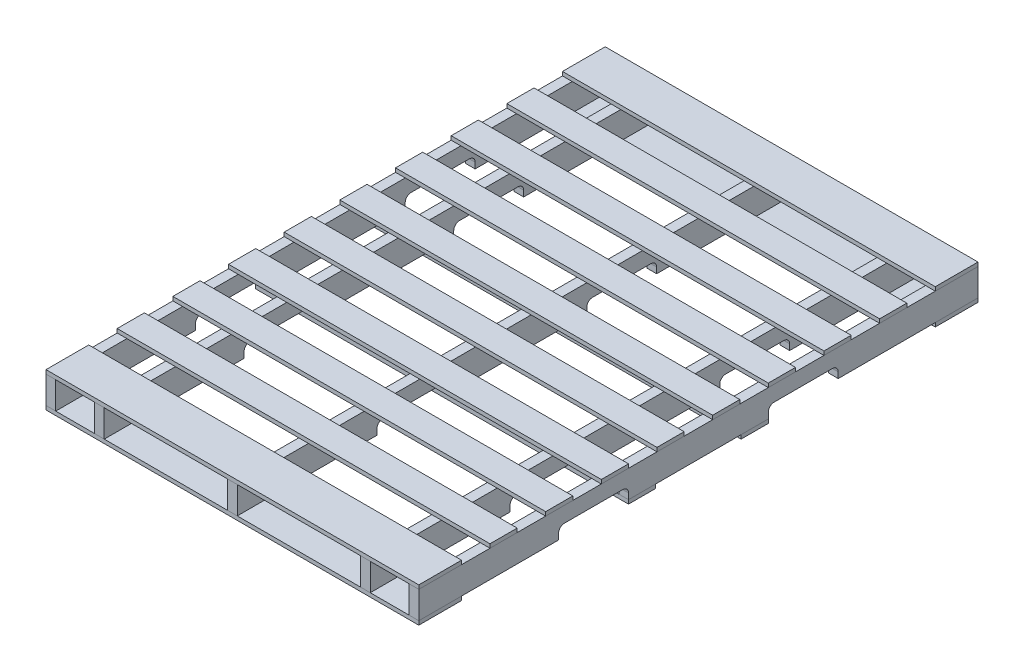
from build123d import *

# Parameters (mm, degrees)
BOSS_EXTRUDE1_DEPTH        = 914.4
BOSS_EXTRUDE1_DEPTH_BACK   = 914.4
SKETCH3_W                  = 31.75
SKETCH3_H                  = 88.9
BOSS_EXTRUDE1_2_DEPTH      = 914.4
BOSS_EXTRUDE1_2_DEPTH_BACK = 914.4
BOSS_EXTRUDE1_3_DEPTH      = 914.4
BOSS_EXTRUDE1_3_DEPTH_BACK = 914.4
BOSS_EXTRUDE1_4_DEPTH      = 914.4
BOSS_EXTRUDE1_4_DEPTH_BACK = 914.4
BOSS_EXTRUDE1_5_DEPTH      = 914.4
BOSS_EXTRUDE1_5_DEPTH_BACK = 914.4
SKETCH4_W                  = 1219.2
SKETCH4_H                  = 139.7
BOSS_EXTRUDE2_DEPTH        = 12.7
BOSS_EXTRUDE2_2_DEPTH      = 12.7
SKETCH4_H_2                = 88.9
BOSS_EXTRUDE2_3_DEPTH      = 12.7
BOSS_EXTRUDE2_4_DEPTH      = 12.7
BOSS_EXTRUDE2_5_DEPTH      = 12.7
BOSS_EXTRUDE2_6_DEPTH      = 12.7
BOSS_EXTRUDE2_7_DEPTH      = 12.7
BOSS_EXTRUDE2_8_DEPTH      = 12.7
BOSS_EXTRUDE2_9_DEPTH      = 12.7
BOSS_EXTRUDE2_10_DEPTH     = 12.7
SKETCH5_W                  = 1219.2
SKETCH5_H                  = 139.7
BOSS_EXTRUDE3_DEPTH        = 12.7
BOSS_EXTRUDE3_2_DEPTH      = 12.7
SKETCH5_H_2                = 88.9
BOSS_EXTRUDE3_3_DEPTH      = 12.7
BOSS_EXTRUDE3_4_DEPTH      = 12.7
CUT_EXTRUDE2_DEPTH         = 1526.071186043
CUT_EXTRUDE2_DEPTH_BACK    = 1526.071186043


with BuildPart() as part:
    # Sketch3 → Boss-Extrude1 (new, two sides: drawn at the far end of the back side and taken through both)
    with BuildSketch(Plane.XY.offset(-BOSS_EXTRUDE1_DEPTH_BACK)):
        with Locations((-593.725, 0)):
            Rectangle(SKETCH3_W, SKETCH3_H)
    extrude(amount=BOSS_EXTRUDE1_DEPTH + BOSS_EXTRUDE1_DEPTH_BACK)


with BuildPart() as body_2:
    # Sketch3 → Boss-Extrude1 2 (new, two sides: drawn at the far end of the back side and taken through both)
    with BuildSketch(Plane.XY.offset(-BOSS_EXTRUDE1_2_DEPTH_BACK)):
        with Locations((434.975, 0)):
            Rectangle(SKETCH3_W, SKETCH3_H)
    extrude(amount=BOSS_EXTRUDE1_2_DEPTH + BOSS_EXTRUDE1_2_DEPTH_BACK)


with BuildPart() as body_3:
    # Sketch3 → Boss-Extrude1 3 (new, two sides: drawn at the far end of the back side and taken through both)
    with BuildSketch(Plane.XY.offset(-BOSS_EXTRUDE1_3_DEPTH_BACK)):
        with Locations((593.725, 0)):
            Rectangle(SKETCH3_W, SKETCH3_H)
    extrude(amount=BOSS_EXTRUDE1_3_DEPTH + BOSS_EXTRUDE1_3_DEPTH_BACK)


with BuildPart() as body_4:
    # Sketch3 → Boss-Extrude1 4 (new, two sides: drawn at the far end of the back side and taken through both)
    with BuildSketch(Plane.XY.offset(-BOSS_EXTRUDE1_4_DEPTH_BACK)):
        with Locations((-434.975, 0)):
            Rectangle(SKETCH3_W, SKETCH3_H)
    extrude(amount=BOSS_EXTRUDE1_4_DEPTH + BOSS_EXTRUDE1_4_DEPTH_BACK)


with BuildPart() as body_5:
    # Sketch3 → Boss-Extrude1 5 (new, two sides: drawn at the far end of the back side and taken through both)
    with BuildSketch(Plane.XY.offset(-BOSS_EXTRUDE1_5_DEPTH_BACK)):
        Rectangle(SKETCH3_W, SKETCH3_H)
    extrude(amount=BOSS_EXTRUDE1_5_DEPTH + BOSS_EXTRUDE1_5_DEPTH_BACK)


with BuildPart() as body_6:
    # Sketch4 → Boss-Extrude2 (new body)
    with BuildSketch(Plane(origin=(0, 44.45, 0), x_dir=(1, 0, 0), z_dir=(0, 1, 0))):
        with Locations((0, -844.55)):
            Rectangle(SKETCH4_W, SKETCH4_H)
    extrude(amount=BOSS_EXTRUDE2_DEPTH)


with BuildPart() as body_7:
    # Sketch4 → Boss-Extrude2 2 (new body)
    with BuildSketch(Plane(origin=(0, 44.45, 0), x_dir=(1, 0, 0), z_dir=(0, 1, 0))):
        with Locations((0, 844.55)):
            Rectangle(SKETCH4_W, SKETCH4_H)
    extrude(amount=BOSS_EXTRUDE2_2_DEPTH)


with BuildPart() as body_8:
    # Sketch4 → Boss-Extrude2 3 (new body)
    with BuildSketch(Plane(origin=(0, 44.45, 0), x_dir=(1, 0, 0), z_dir=(0, 1, 0))):
        with Locations((0, -637.116666667)):
            Rectangle(SKETCH4_W, SKETCH4_H_2)
    extrude(amount=BOSS_EXTRUDE2_3_DEPTH)


with BuildPart() as body_9:
    # Sketch4 → Boss-Extrude2 4 (new body)
    with BuildSketch(Plane(origin=(0, 44.45, 0), x_dir=(1, 0, 0), z_dir=(0, 1, 0))):
        with Locations((0, -455.083333333)):
            Rectangle(SKETCH4_W, SKETCH4_H_2)
    extrude(amount=BOSS_EXTRUDE2_4_DEPTH)


with BuildPart() as body_10:
    # Sketch4 → Boss-Extrude2 5 (new body)
    with BuildSketch(Plane(origin=(0, 44.45, 0), x_dir=(1, 0, 0), z_dir=(0, 1, 0))):
        with Locations((0, 637.116666667)):
            Rectangle(SKETCH4_W, SKETCH4_H_2)
    extrude(amount=BOSS_EXTRUDE2_5_DEPTH)


with BuildPart() as body_11:
    # Sketch4 → Boss-Extrude2 6 (new body)
    with BuildSketch(Plane(origin=(0, 44.45, 0), x_dir=(1, 0, 0), z_dir=(0, 1, 0))):
        with Locations((0, -91.016666667)):
            Rectangle(SKETCH4_W, SKETCH4_H_2)
    extrude(amount=BOSS_EXTRUDE2_6_DEPTH)


with BuildPart() as body_12:
    # Sketch4 → Boss-Extrude2 7 (new body)
    with BuildSketch(Plane(origin=(0, 44.45, 0), x_dir=(1, 0, 0), z_dir=(0, 1, 0))):
        with Locations((0, -273.05)):
            Rectangle(SKETCH4_W, SKETCH4_H_2)
    extrude(amount=BOSS_EXTRUDE2_7_DEPTH)


with BuildPart() as body_13:
    # Sketch4 → Boss-Extrude2 8 (new body)
    with BuildSketch(Plane(origin=(0, 44.45, 0), x_dir=(1, 0, 0), z_dir=(0, 1, 0))):
        with Locations((0, 455.083333333)):
            Rectangle(SKETCH4_W, SKETCH4_H_2)
    extrude(amount=BOSS_EXTRUDE2_8_DEPTH)


with BuildPart() as body_14:
    # Sketch4 → Boss-Extrude2 9 (new body)
    with BuildSketch(Plane(origin=(0, 44.45, 0), x_dir=(1, 0, 0), z_dir=(0, 1, 0))):
        with Locations((0, 273.05)):
            Rectangle(SKETCH4_W, SKETCH4_H_2)
    extrude(amount=BOSS_EXTRUDE2_9_DEPTH)


with BuildPart() as body_15:
    # Sketch4 → Boss-Extrude2 10 (new body)
    with BuildSketch(Plane(origin=(0, 44.45, 0), x_dir=(1, 0, 0), z_dir=(0, 1, 0))):
        with Locations((0, 91.016666667)):
            Rectangle(SKETCH4_W, SKETCH4_H_2)
    extrude(amount=BOSS_EXTRUDE2_10_DEPTH)


with BuildPart() as body_16:
    # Sketch5 → Boss-Extrude3 (new body)
    with BuildSketch(Plane.XZ.offset(44.45)):
        with Locations((0, 844.55)):
            Rectangle(SKETCH5_W, SKETCH5_H)
    extrude(amount=BOSS_EXTRUDE3_DEPTH)


with BuildPart() as body_17:
    # Sketch5 → Boss-Extrude3 2 (new body)
    with BuildSketch(Plane.XZ.offset(44.45)):
        with Locations((0, -844.55)):
            Rectangle(SKETCH5_W, SKETCH5_H)
    extrude(amount=BOSS_EXTRUDE3_2_DEPTH)


with BuildPart() as body_18:
    # Sketch5 → Boss-Extrude3 3 (new body)
    with BuildSketch(Plane.XZ.offset(44.45)):
        with Locations((0, 184.15)):
            Rectangle(SKETCH5_W, SKETCH5_H_2)
    extrude(amount=BOSS_EXTRUDE3_3_DEPTH)


with BuildPart() as body_19:
    # Sketch5 → Boss-Extrude3 4 (new body)
    with BuildSketch(Plane.XZ.offset(44.45)):
        with Locations((0, -184.15)):
            Rectangle(SKETCH5_W, SKETCH5_H_2)
    extrude(amount=BOSS_EXTRUDE3_4_DEPTH)


with BuildPart() as cut_extrude2_tool:
    # Sketch8 → Cut-Extrude2 (new, two sides: drawn at the far end of the back side and taken through both)
    with BuildSketch(Plane(origin=(609.6, 0, 0), x_dir=(0, 0, -1), z_dir=(1, 0, 0)).offset(-CUT_EXTRUDE2_DEPTH_BACK)):
        with BuildLine():
            Line((-228.6, -44.45), (-457.2, -44.45))
            Line((-457.2, -44.45), (-457.2, -25.4))
            ThreePointArc((-457.2, -25.4), (-451.620384182, -11.929615818), (-438.15, -6.35))
            Line((-438.15, -6.35), (-247.65, -6.35))
            ThreePointArc((-247.65, -6.35), (-234.179615818, -11.929615818), (-228.6, -25.4))
            Line((-228.6, -25.4), (-228.6, -44.45))
        make_face()
        with BuildLine():
            Line((228.6, -44.45), (457.2, -44.45))
            Line((457.2, -44.45), (457.2, -25.4))
            ThreePointArc((457.2, -25.4), (451.620384182, -11.929615818), (438.15, -6.35))
            Line((438.15, -6.35), (247.65, -6.35))
            ThreePointArc((247.65, -6.35), (234.179615818, -11.929615818), (228.6, -25.4))
            Line((228.6, -25.4), (228.6, -44.45))
        make_face()
    extrude(amount=CUT_EXTRUDE2_DEPTH + CUT_EXTRUDE2_DEPTH_BACK)


with BuildPart() as part_1:
    add(part.part)

    # Cut-Extrude2: cut by cut_extrude2_tool
    add(cut_extrude2_tool.part, mode=Mode.SUBTRACT)


with BuildPart() as body_2_1:
    add(body_2.part)

    # Cut-Extrude2: cut by cut_extrude2_tool
    add(cut_extrude2_tool.part, mode=Mode.SUBTRACT)


with BuildPart() as body_3_1:
    add(body_3.part)

    # Cut-Extrude2: cut by cut_extrude2_tool
    add(cut_extrude2_tool.part, mode=Mode.SUBTRACT)


with BuildPart() as body_4_1:
    add(body_4.part)

    # Cut-Extrude2: cut by cut_extrude2_tool
    add(cut_extrude2_tool.part, mode=Mode.SUBTRACT)


with BuildPart() as body_5_1:
    add(body_5.part)

    # Cut-Extrude2: cut by cut_extrude2_tool
    add(cut_extrude2_tool.part, mode=Mode.SUBTRACT)


solid = Compound([body_6.part, body_7.part, body_8.part, body_9.part, body_10.part, body_11.part, body_12.part, body_13.part, body_14.part, body_15.part, body_16.part, body_17.part, body_18.part, body_19.part, part_1.part, body_2_1.part, body_3_1.part, body_4_1.part, body_5_1.part])
